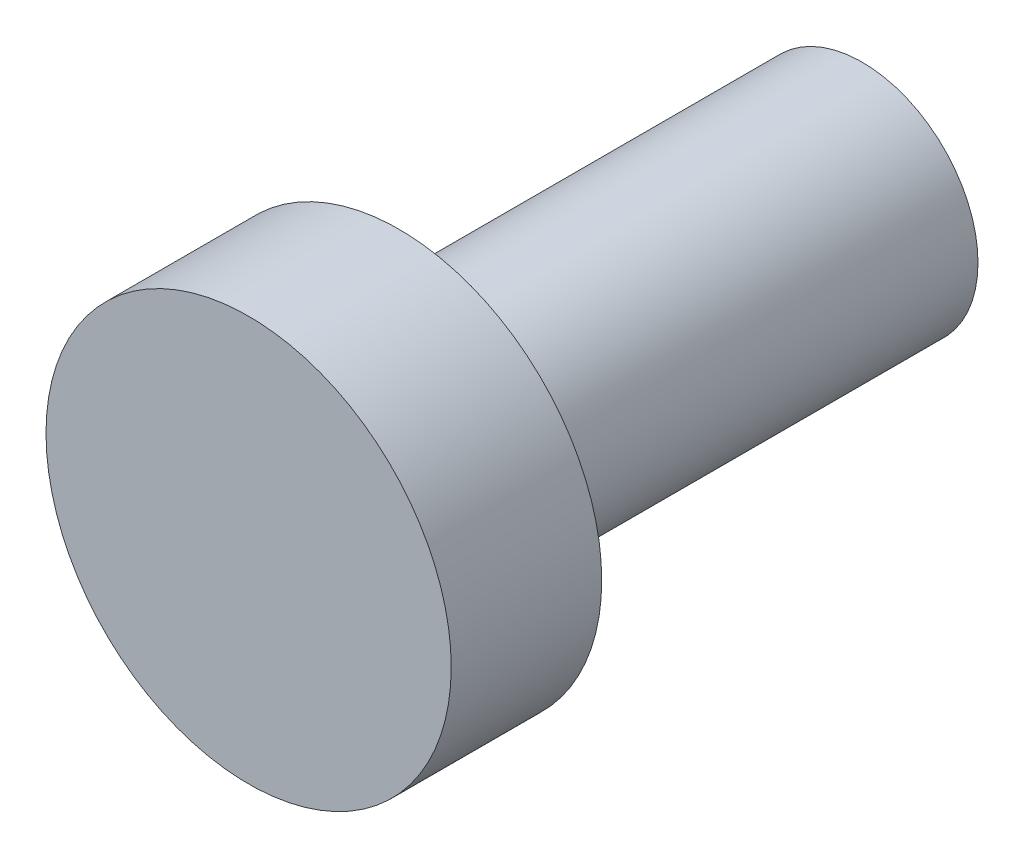
from build123d import *

# Parameters (mm, degrees)
SKETCH1_R                               = 1.75
CONSERVATIVE_BUTTON_HEAD_ENVELOPE_DEPTH = 1.3
M2X0P4X4_THREAD_MAJOR_ENVELOPE_START    = -4
SKETCH2_R                               = 1
M2X0P4X4_THREAD_MAJOR_ENVELOPE_DEPTH    = 4


with BuildPart() as part:
    # Sketch1 → Conservative_Button_Head_Envelope (new body)
    with BuildSketch(Plane.XY):
        Circle(SKETCH1_R)
    extrude(amount=CONSERVATIVE_BUTTON_HEAD_ENVELOPE_DEPTH)

    # Sketch2 → M2x0p4x4_Thread_Major_Envelope (add)
    with BuildSketch(Plane.XY.offset(M2X0P4X4_THREAD_MAJOR_ENVELOPE_START)):
        Circle(SKETCH2_R)
    extrude(amount=M2X0P4X4_THREAD_MAJOR_ENVELOPE_DEPTH)


solid = part.part
